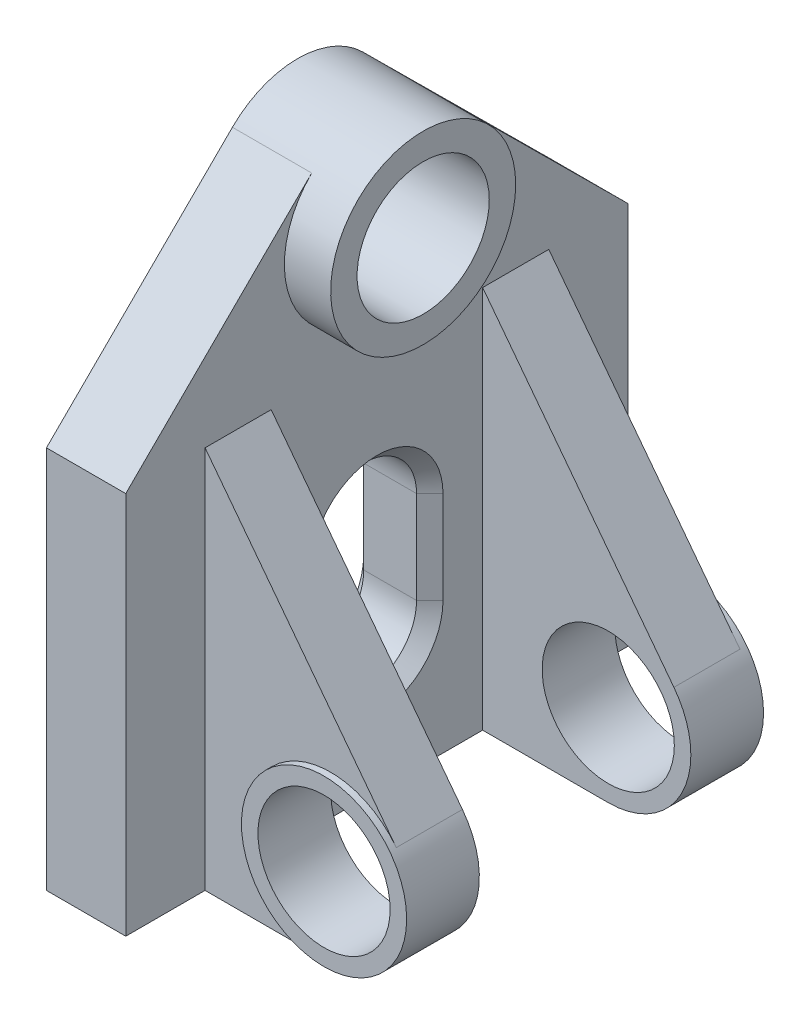
from build123d import *

# Parameters (mm, degrees)
BOSS_EXTRUDE1_DEPTH = 12
SKETCH1_3_R         = 10
BOSS_EXTRUDE2_DEPTH = 19
BOSS_EXTRUDE3_START = 16
BOSS_EXTRUDE3_DEPTH = 10
BOSS_EXTRUDE4_START = 16
SKETCH2_4_R         = 10
BOSS_EXTRUDE4_DEPTH = 11
CHAMFER1_SIZE       = 2


with BuildPart() as part:
    # Sketch1 → Boss-Extrude1 (new body)
    with BuildSketch(Plane(origin=(0, 0, 0), x_dir=(0, 0, -1), z_dir=(1, 0, 0))):
        with BuildLine():
            Line((38, 0), (38, 58))
            Line((38, 58), (9.863920086, 85.934942403))
            ThreePointArc((9.863920086, 85.934942403), (12.924683385, 81.380758255), (14, 76))
            ThreePointArc((14, 76), (-5.380758255, 63.075316615), (-9.863920086, 85.934942403))
            Line((-9.863920086, 85.934942403), (-38, 58))
            Line((-38, 58), (-38, 0))
            Line((-38, 0), (38, 0))
        make_face()
        with BuildLine():
            ThreePointArc((-8, 34), (0, 42), (8, 34))
            Line((8, 34), (8, 20))
            ThreePointArc((8, 20), (0, 12), (-8, 20))
            Line((-8, 20), (-8, 34))
        make_face(mode=Mode.SUBTRACT)
    extrude(amount=BOSS_EXTRUDE1_DEPTH)

    # Sketch1<3> → Boss-Extrude2 (add)
    with BuildSketch(Plane(origin=(0, 0, 0), x_dir=(0, 0, -1), z_dir=(1, 0, 0))):
        with BuildLine():
            ThreePointArc((14, 76), (12.924683385, 81.380758255), (9.863920086, 85.934942403))
            ThreePointArc((9.863920086, 85.934942403), (0, 90), (-9.863920086, 85.934942403))
            ThreePointArc((-9.863920086, 85.934942403), (-5.380758255, 63.075316615), (14, 76))
        make_face()
        with Locations((0, 76)):
            Circle(SKETCH1_3_R, mode=Mode.SUBTRACT)
    extrude(amount=BOSS_EXTRUDE2_DEPTH)

    # Sketch2 → Boss-Extrude3 (add)
    with BuildSketch(Plane.XY.offset(BOSS_EXTRUDE3_START)):
        with BuildLine():
            Line((12, 58), (12, 0))
            Line((12, 0), (31, 0))
            ThreePointArc((31, 0), (19.796343324, 18.043291177), (40.936820993, 20.083507668))
            Line((40.936820993, 20.083507668), (12, 58))
        make_face()
    boss_extrude3 = extrude(amount=BOSS_EXTRUDE3_DEPTH)

    # Sketch2<4> → Boss-Extrude4 (add)
    with BuildSketch(Plane.XY.offset(BOSS_EXTRUDE4_START)):
        with BuildLine():
            ThreePointArc((40.936820993, 20.083507668), (19.796343324, 18.043291177), (31, 0))
            ThreePointArc((31, 0), (39.838834765, 3.661165235), (43.5, 12.5))
            ThreePointArc((43.5, 12.5), (42.841880392, 16.502482828), (40.936820993, 20.083507668))
        make_face()
        with Locations((31, 12.5)):
            Circle(SKETCH2_4_R, mode=Mode.SUBTRACT)
    boss_extrude4 = extrude(amount=BOSS_EXTRUDE4_DEPTH)

    # Mirror2: Boss-Extrude3, Boss-Extrude4 across plane
    add(boss_extrude3.mirror(Plane.XY))
    add(boss_extrude4.mirror(Plane.XY))

    # Chamfer1
    chamfer1_edges = [part.edges().sort_by_distance(p)[0] for p in [
        (0, 42, 0),
        (0, 27, -8),
        (0, 12, 0),
        (0, 27, 8),
        (12, 42, 0),
        (12, 27, 8),
        (12, 27, -8),
        (12, 12, 0),
    ]]
    chamfer(chamfer1_edges, length=CHAMFER1_SIZE)


solid = part.part
